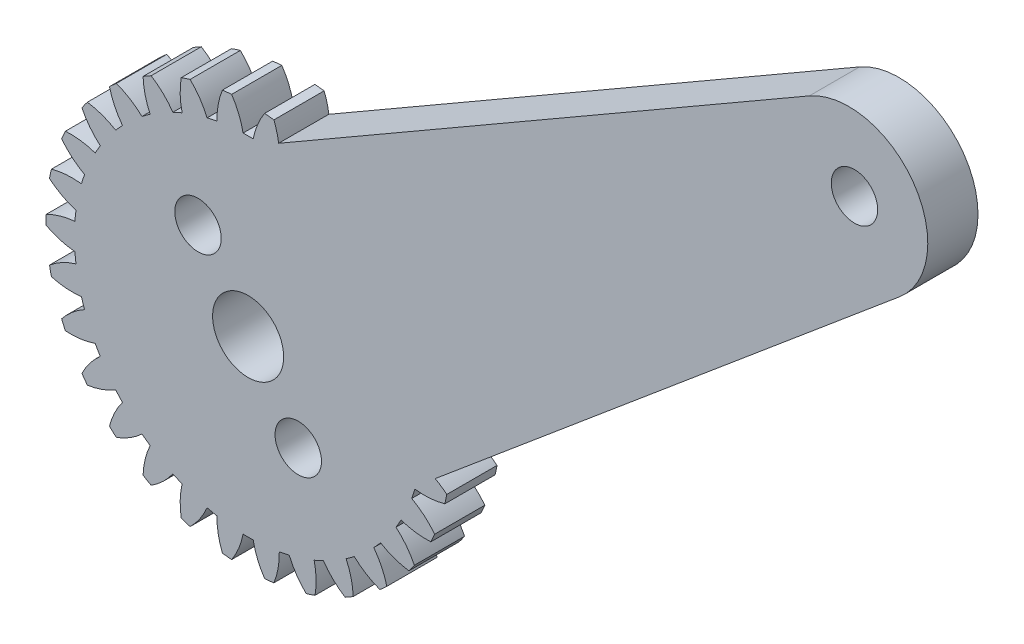
from build123d import *

# Parameters (mm, degrees)
SKETCH1_R           = 12.8
BOSS_EXTRUDE1_DEPTH = 3.18
CUT_EXTRUDE1_DEPTH  = 19.379129468
CIRPATTERN1_COUNT   = 30
SKETCH4_R           = 2.25
CUT_EXTRUDE3_DEPTH  = 19.349437359
BOSS_EXTRUDE6_START = -3.18
BOSS_EXTRUDE6_DEPTH = 3.18
SKETCH8_R           = 1.47
CUT_EXTRUDE4_DEPTH  = 54.506204937
SKETCH9_R           = 1.47
CUT_EXTRUDE5_DEPTH  = 54.506204937


with BuildPart() as part:
    # Sketch1 → Boss-Extrude1 (new body)
    with BuildSketch(Plane.XY):
        with Locations(Location((0, 0, 0), (0, 0, 180))):
            Circle(SKETCH1_R)
    extrude(amount=BOSS_EXTRUDE1_DEPTH)

    # Sketch2 → Cut-Extrude1 (cut, through all)
    with BuildSketch(Plane.XY.offset(3.18)):
        with BuildLine():
            ThreePointArc((-0.321034752, 10.995314306), (0, 11), (0.321034752, 10.995314306))
            ThreePointArc((0.321034752, 10.995314306), (0.594388904, 11.912556329), (1.044293354, 12.75732932))
            ThreePointArc((1.044293354, 12.75732932), (0, 12.8), (-1.044293354, 12.75732932))
            ThreePointArc((-1.044293354, 12.75732932), (-0.594388904, 11.912556329), (-0.321034752, 10.995314306))
        make_face()
    cut_extrude1 = extrude(amount=-CUT_EXTRUDE1_DEPTH, mode=Mode.SUBTRACT)

    # CirPattern1: Cut-Extrude1 ×30 about axis
    cirpattern1_axis = Axis((0, 0, 0), (0, 0, 1))
    for i in range(1, CIRPATTERN1_COUNT):
        add(cut_extrude1.rotate(cirpattern1_axis, i * 360 / CIRPATTERN1_COUNT), mode=Mode.SUBTRACT)

    # Sketch4 → Cut-Extrude3 (cut, through all)
    with BuildSketch(Plane.XY.offset(3.18)):
        Circle(SKETCH4_R)
    extrude(amount=-CUT_EXTRUDE3_DEPTH, mode=Mode.SUBTRACT)

    # Sketch6 → Boss-Extrude6 (add)
    with BuildSketch(Plane(origin=(0, 0, 0), x_dir=(-1, 0, 0), z_dir=(0, 0, -1)).offset(BOSS_EXTRUDE6_START)):
        with BuildLine():
            Line((-35.536396094, 30.96349829), (-0.895379942, 10.96349829))
            ThreePointArc((-0.895379942, 10.96349829), (-9.010672487, 6.3093408), (-10.608556418, -2.908355332))
            Line((-10.608556418, -2.908355332), (-41.250334142, 22.803149056))
            ThreePointArc((-41.250334142, 22.803149056), (-42.132156315, 29.501253453), (-35.536396094, 30.96349829))
        make_face()
    extrude(amount=BOSS_EXTRUDE6_DEPTH)

    # Sketch8 → Cut-Extrude4 (cut, through all)
    with BuildSketch(Plane.XY.offset(3.18)):
        with Locations((-3.173453683, 4.526502263)):
            Circle(SKETCH8_R)
        with Locations((3.173453683, -4.526502263)):
            Circle(SKETCH8_R)
    extrude(amount=-CUT_EXTRUDE4_DEPTH, mode=Mode.SUBTRACT)

    # Sketch9 → Cut-Extrude5 (cut, through all)
    with BuildSketch(Plane(origin=(0, 0, 0), x_dir=(-1, 0, 0), z_dir=(0, 0, -1))):
        with Locations((-38.393365118, 26.883323673)):
            Circle(SKETCH9_R)
    extrude(amount=-CUT_EXTRUDE5_DEPTH, mode=Mode.SUBTRACT)


solid = part.part
